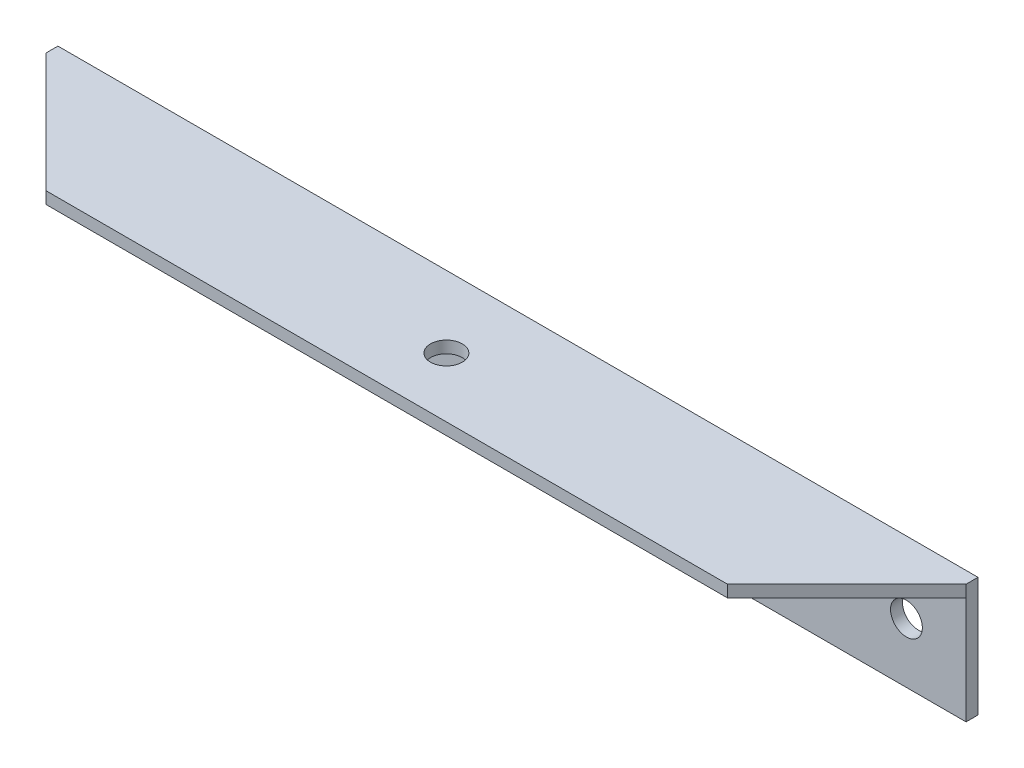
from build123d import *

# Parameters (mm, degrees)
SKETCH1_W                = 231.4
SKETCH1_H                = 30
BOSS_EXTRUDE1_DEPTH      = 3
BOSS_EXTRUDE2_DEPTH      = 3
F_8_0_8_DIAMETER_HOLE2_D = 8
F_8_0_8_DIAMETER_HOLE1_D = 8


with BuildPart() as part:
    # Sketch1 → Boss-Extrude1 (new body)
    with BuildSketch(Plane.XY):
        with Locations((0, -15)):
            Rectangle(SKETCH1_W, SKETCH1_H)
    extrude(amount=BOSS_EXTRUDE1_DEPTH)

    # Sketch3 → Boss-Extrude2 (add)
    with BuildSketch(Plane(origin=(0, 0, 0), x_dir=(1, 0, 0), z_dir=(0, 1, 0))):
        Polygon((-85.7, -33), (85.7, -33), (115.7, -3), (-115.7, -3), align=None)
    extrude(amount=-BOSS_EXTRUDE2_DEPTH)

    # Ø8.0 (8) Diameter Hole2 (through all)
    with Locations(Plane(origin=(0, 0, 0), x_dir=(-1, 0, 0), z_dir=(0, 0, -1))):
        with Locations((100.7, -15), (-100.7, -15)):
            Hole(F_8_0_8_DIAMETER_HOLE2_D / 2)

    # Ø8.0 (8) Diameter Hole1 (through all)
    with Locations(Plane(origin=(0, -3, 0), x_dir=(-1, 0, 0), z_dir=(0, -1, 0))):
        with Locations((0, -18)):
            Hole(F_8_0_8_DIAMETER_HOLE1_D / 2)


solid = part.part
